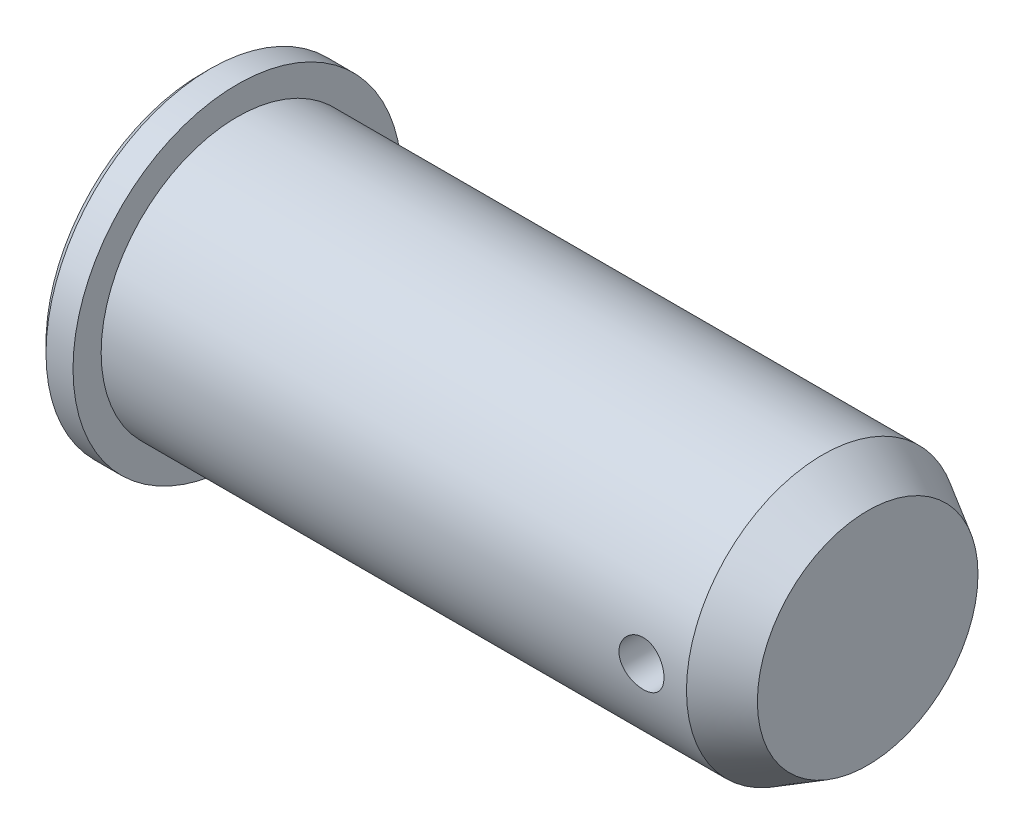
from build123d import *

# Parameters (mm, degrees)
CHAMFER_1_SIZE      = 2
SKETCH_2_R          = 5
CUT_EXTRUDE_1_DEPTH = 171.553510665


with BuildPart() as part:
    # 草图1 → 旋转1 (revolve)
    with BuildSketch(Plane.XY, mode=Mode.PRIVATE) as revolve_1_sk:
        Polygon((0, 0), (0, 36.5), (8, 36.5), (8, 30.25), (138, 30.25), (148, 24.5), (148, 0), align=None)
    revolve(revolve_1_sk.sketch.rotate(Axis((0, 0, 0), (1, 0, 0)), 90), axis=Axis((0, 0, 0), (1, 0, 0)))

    # 倒角1
    chamfer_1_edges = [part.edges().sort_by_distance(p)[0] for p in [
        (0, 0, -36.5),
    ]]
    chamfer(chamfer_1_edges, length=CHAMFER_1_SIZE)

    # 草图2 → 切除-拉伸1 (cut, through all)
    with BuildSketch(Plane.XY.offset(40)):
        with Locations((128, 0)):
            Circle(SKETCH_2_R)
    extrude(amount=-CUT_EXTRUDE_1_DEPTH, mode=Mode.SUBTRACT)


solid = part.part
